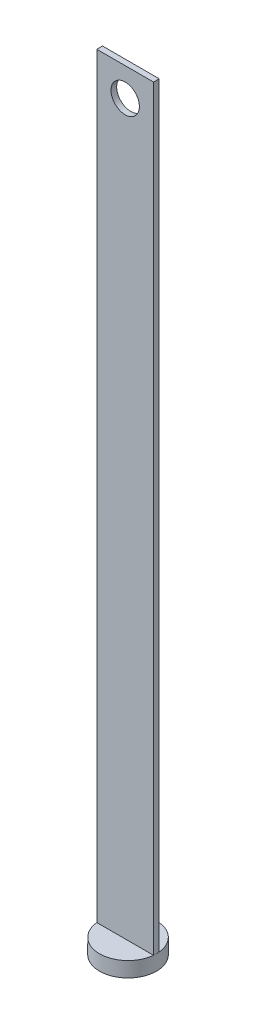
from build123d import *

# Parameters (mm, degrees)
SZKIC1_W                    = 30
SZKIC1_H                    = 400
DODANIE_WYCI_GNI_CIE1_DEPTH = 3
SZKIC2_R                    = 7.5
WYTNIJ_WYCI_GNI_CIE1_DEPTH  = 3
SZKIC3_R                    = 15.074813432
DODANIE_WYCI_GNI_CIE2_DEPTH = 8


with BuildPart() as part:
    # Szkic1 → Dodanie-wyciągnięcie1 (new body)
    with BuildSketch(Plane.XY):
        with Locations((-207.813580858, 246.462746709)):
            Rectangle(SZKIC1_W, SZKIC1_H)
    extrude(amount=DODANIE_WYCI_GNI_CIE1_DEPTH)

    # Szkic2 → Wytnij-wyciągnięcie1 (cut)
    with BuildSketch(Plane.XY.offset(3)):
        with Locations((-207.813580858, 431.462746709)):
            Circle(SZKIC2_R)
    extrude(amount=-WYTNIJ_WYCI_GNI_CIE1_DEPTH, mode=Mode.SUBTRACT)

    # Szkic3 → Dodanie-wyciągnięcie2 (add)
    with BuildSketch(Plane.XZ.offset(-46.462746709)):
        with Locations(Location((-207.813580858, 1.5, 0), (0, 0, 5.710593137))):
            Circle(SZKIC3_R)
    extrude(amount=DODANIE_WYCI_GNI_CIE2_DEPTH)


solid = part.part
